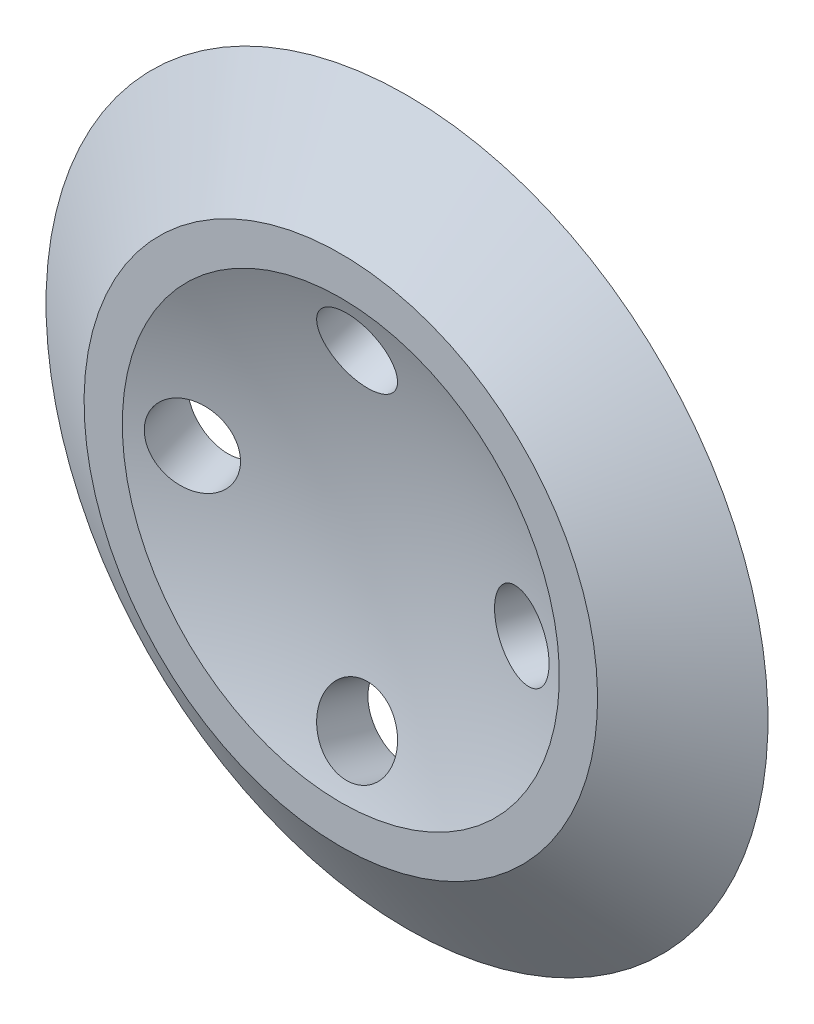
from build123d import *

# Parameters (mm, degrees)
PATTERN_CIRCULAR_1_COUNT = 4
MOVE_BODY_1_ANGLE        = 90


with BuildPart() as part:
    # 草图1 → 旋转1 (revolve)
    with BuildSketch(Plane(origin=(0, 0, 0), x_dir=(0, 0, -1), z_dir=(1, 0, 0)), mode=Mode.PRIVATE) as revolve_1_sk:
        with BuildLine():
            Line((0, 0), (0, -4.367835819))
            Line((0, -4.367835819), (60, -4.367835819))
            Line((60, -4.367835819), (42.679491924, 6.632164181))
            Line((42.679491924, 6.632164181), (36.32612495, 6.632164181))
            ThreePointArc((36.32612495, 6.632164181), (18.463294368, 1.671632263), (0, 0))
        make_face()
    revolve(revolve_1_sk.sketch.rotate(Axis((0, 23.869545483, 0), (0, -1, 0)), 180), axis=Axis((0, 23.869545483, 0), (0, -1, 0)))

    # 草图2 → 切除-旋转1 (revolve, cut)
    with BuildSketch(Plane.XY, mode=Mode.PRIVATE) as cut_revolve_1_sk:
        Polygon((23.11658969, 18.792484499), (29.364790714, 20.584127312), (39.564082896, -14.98503156), (33.315881872, -16.776674373), align=None)
    cut_revolve_1 = revolve(cut_revolve_1_sk.sketch.rotate(Axis((0, 99.409613277, 0), (0.2756373558169999, -0.9612616959383187, 0)), 180), axis=Axis((0, 99.409613277, 0), (0.2756373558169999, -0.9612616959383187, 0)), mode=Mode.SUBTRACT)

    # 阵列(圆周)1: 切除-旋转1 ×4 about axis
    pattern_circular_1_axis = Axis((0, 0, 0), (0, 1, 0))
    for i in range(1, PATTERN_CIRCULAR_1_COUNT):
        add(cut_revolve_1.rotate(pattern_circular_1_axis, i * 360 / PATTERN_CIRCULAR_1_COUNT), mode=Mode.SUBTRACT)


with BuildPart() as part_1:
    # Move Body 1: moved
    add(part.part.rotate(Axis((0, 1.132164181, 0), (1, 0, 0)), MOVE_BODY_1_ANGLE))


solid = part_1.part
